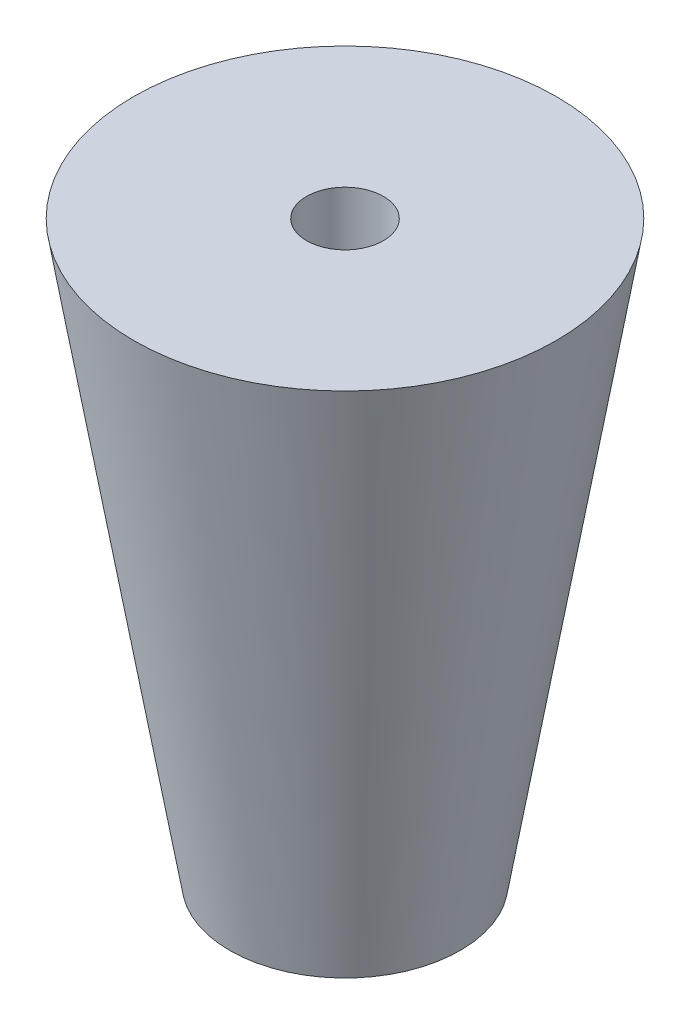
from build123d import *


with BuildPart() as part:
    # Sketch1 → Revolve1 (revolve)
    with BuildSketch(Plane(origin=(0, 0, 0), x_dir=(0, 0, -1), z_dir=(1, 0, 0)), mode=Mode.PRIVATE) as revolve1_sk:
        Polygon((1, 15), (5.5, 15), (3, 0), (1, 0), align=None)
    revolve(revolve1_sk.sketch.rotate(Axis((0, 0, 0), (0, -1, 0)), 180), axis=Axis((0, 0, 0), (0, -1, 0)))


solid = part.part
